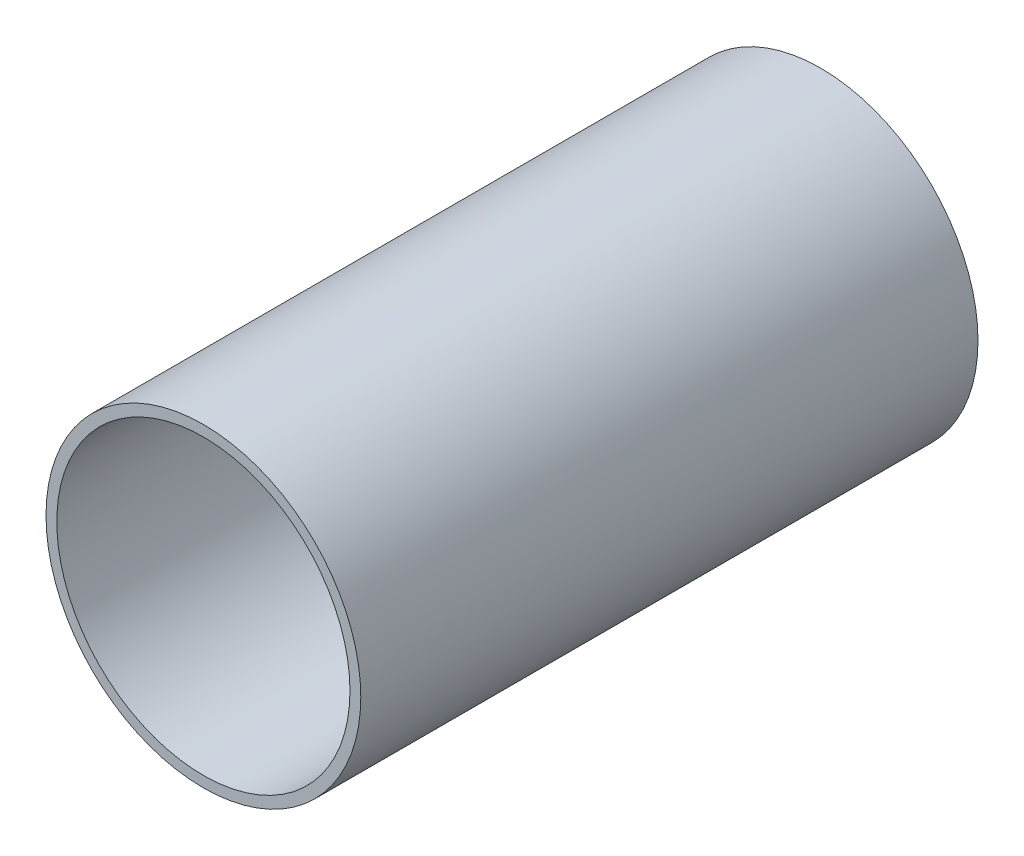
from build123d import *

# Parameters (mm, degrees)
SKETCH1_R           = 2.55
SKETCH1_R_2         = 2.375
BOSS_EXTRUDE1_DEPTH = 10


with BuildPart() as part:
    # Sketch1 → Boss-Extrude1 (new body)
    with BuildSketch(Plane.XY):
        Circle(SKETCH1_R)
        Circle(SKETCH1_R_2, mode=Mode.SUBTRACT)
    extrude(amount=BOSS_EXTRUDE1_DEPTH)


solid = part.part
